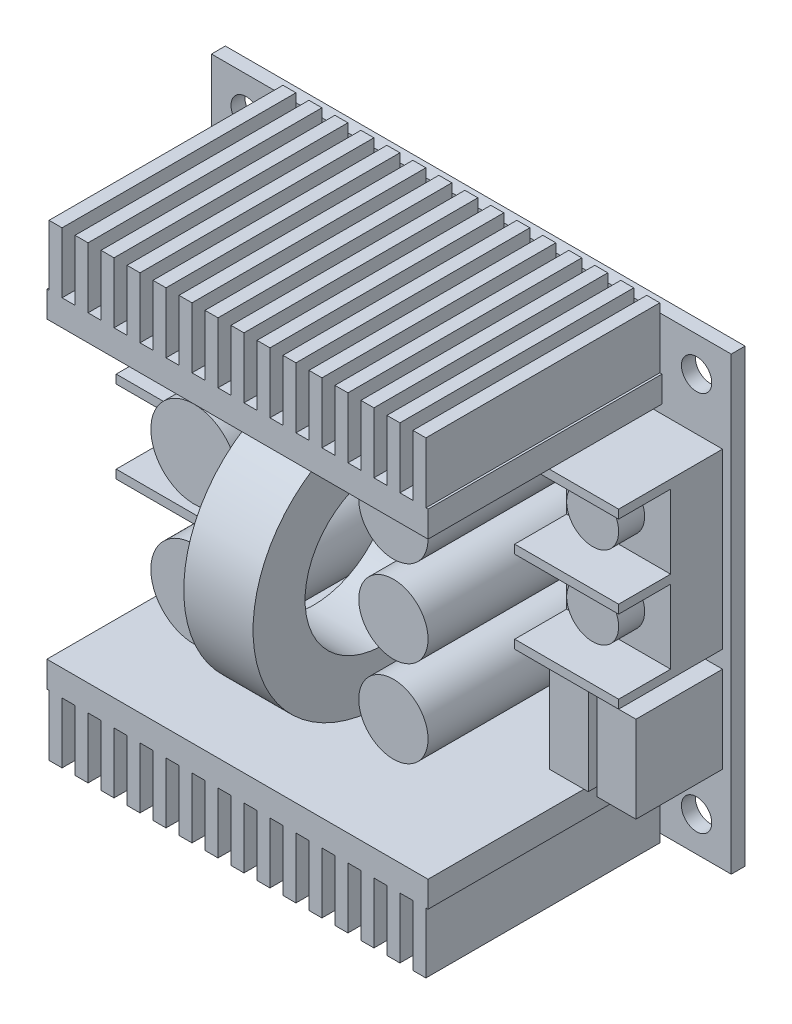
from build123d import *

# Parameters (mm, degrees)
SKETCH1_W           = 60
SKETCH1_H           = 52
BOSS_EXTRUDE1_DEPTH = 0.8
SKETCH2_W           = 44
SKETCH2_H           = 10
BOSS_EXTRUDE2_DEPTH = 27
SKETCH3_W           = 1.5
SKETCH3_H           = 7
CUT_EXTRUDE1_DEPTH  = 27
SKETCH4_R           = 1.75
CUT_EXTRUDE2_DEPTH  = 49.559242169
SKETCH5_W           = 4.5
SKETCH5_H           = 10
BOSS_EXTRUDE3_DEPTH = 10
SKETCH6_W           = 12
SKETCH6_H           = 20
BOSS_EXTRUDE4_DEPTH = 12
SKETCH7_W           = 12
SKETCH7_H           = 8.5
CUT_EXTRUDE3_DEPTH  = 6
SKETCH8_R           = 3
BOSS_EXTRUDE5_DEPTH = 3
SKETCH9_R           = 4
BOSS_EXTRUDE6_DEPTH = 20
SKETCH10_R          = 5
BOSS_EXTRUDE7_DEPTH = 22
SKETCH11_R          = 15
SKETCH11_R_2        = 9
BOSS_EXTRUDE8_DEPTH = 4


with BuildPart() as part:
    # Sketch1 → Boss-Extrude1 (new, symmetric)
    with BuildSketch(Plane.XY):
        Rectangle(SKETCH1_W, SKETCH1_H)
    extrude(amount=BOSS_EXTRUDE1_DEPTH, both=True)

    # Sketch2 → Boss-Extrude2 (add)
    with BuildSketch(Plane.XY.offset(0.8)):
        with Locations((0, -22)):
            Rectangle(SKETCH2_W, SKETCH2_H)
        with Locations((0, 22)):
            Rectangle(SKETCH2_W, SKETCH2_H)
    extrude(amount=BOSS_EXTRUDE2_DEPTH)

    # Sketch3 → Cut-Extrude1 (cut)
    with BuildSketch(Plane.XY.offset(27.8)):
        with Locations((-22.5, -23.5)):
            Rectangle(SKETCH3_W, SKETCH3_H)
        with Locations((-19.5, -23.5)):
            Rectangle(SKETCH3_W, SKETCH3_H)
        with Locations((-16.5, -23.5)):
            Rectangle(SKETCH3_W, SKETCH3_H)
        with Locations((-13.5, -23.5)):
            Rectangle(SKETCH3_W, SKETCH3_H)
        with Locations((-10.5, -23.5)):
            Rectangle(SKETCH3_W, SKETCH3_H)
        with Locations((-7.5, -23.5)):
            Rectangle(SKETCH3_W, SKETCH3_H)
        with Locations((-4.5, -23.5)):
            Rectangle(SKETCH3_W, SKETCH3_H)
        with Locations((-1.5, -23.5)):
            Rectangle(SKETCH3_W, SKETCH3_H)
        with Locations((1.5, -23.5)):
            Rectangle(SKETCH3_W, SKETCH3_H)
        with Locations((4.5, -23.5)):
            Rectangle(SKETCH3_W, SKETCH3_H)
        with Locations((7.5, -23.5)):
            Rectangle(SKETCH3_W, SKETCH3_H)
        with Locations((10.5, -23.5)):
            Rectangle(SKETCH3_W, SKETCH3_H)
        with Locations((13.5, -23.5)):
            Rectangle(SKETCH3_W, SKETCH3_H)
        with Locations((16.5, -23.5)):
            Rectangle(SKETCH3_W, SKETCH3_H)
        with Locations((19.5, -23.5)):
            Rectangle(SKETCH3_W, SKETCH3_H)
        with Locations((22.5, -23.5)):
            Rectangle(SKETCH3_W, SKETCH3_H)
        with Locations((22.5, 23.5)):
            Rectangle(SKETCH3_W, SKETCH3_H)
        with Locations((19.5, 23.5)):
            Rectangle(SKETCH3_W, SKETCH3_H)
        with Locations((16.5, 23.5)):
            Rectangle(SKETCH3_W, SKETCH3_H)
        with Locations((13.5, 23.5)):
            Rectangle(SKETCH3_W, SKETCH3_H)
        with Locations((10.5, 23.5)):
            Rectangle(SKETCH3_W, SKETCH3_H)
        with Locations((7.5, 23.5)):
            Rectangle(SKETCH3_W, SKETCH3_H)
        with Locations((4.5, 23.5)):
            Rectangle(SKETCH3_W, SKETCH3_H)
        with Locations((1.5, 23.5)):
            Rectangle(SKETCH3_W, SKETCH3_H)
        with Locations((-1.5, 23.5)):
            Rectangle(SKETCH3_W, SKETCH3_H)
        with Locations((-4.5, 23.5)):
            Rectangle(SKETCH3_W, SKETCH3_H)
        with Locations((-7.5, 23.5)):
            Rectangle(SKETCH3_W, SKETCH3_H)
        with Locations((-10.5, 23.5)):
            Rectangle(SKETCH3_W, SKETCH3_H)
        with Locations((-13.5, 23.5)):
            Rectangle(SKETCH3_W, SKETCH3_H)
        with Locations((-16.5, 23.5)):
            Rectangle(SKETCH3_W, SKETCH3_H)
        with Locations((-19.5, 23.5)):
            Rectangle(SKETCH3_W, SKETCH3_H)
        with Locations((-22.5, 23.5)):
            Rectangle(SKETCH3_W, SKETCH3_H)
    extrude(amount=-CUT_EXTRUDE1_DEPTH, mode=Mode.SUBTRACT)

    # Sketch4 → Cut-Extrude2 (cut, through all)
    with BuildSketch(Plane.XY.offset(0.8)):
        with Locations((-26, -22)):
            Circle(SKETCH4_R)
        with Locations(Location((-26, 22, 0), (0, 0, 180))):
            Circle(SKETCH4_R)
        with Locations((26, 22)):
            Circle(SKETCH4_R)
        with Locations(Location((26, -22, 0), (0, 0, 180))):
            Circle(SKETCH4_R)
    extrude(amount=-CUT_EXTRUDE2_DEPTH, mode=Mode.SUBTRACT)

    # Sketch5 → Boss-Extrude3 (add)
    with BuildSketch(Plane.XY.offset(0.8)):
        with Locations((21.25, -11)):
            Rectangle(SKETCH5_W, SKETCH5_H)
        with Locations((26.75, -11)):
            Rectangle(SKETCH5_W, SKETCH5_H)
    extrude(amount=BOSS_EXTRUDE3_DEPTH)

    # Sketch6 → Boss-Extrude4 (add)
    with BuildSketch(Plane.XY.offset(0.8)):
        with Locations((23, 6)):
            Rectangle(SKETCH6_W, SKETCH6_H)
        with Locations((-23, 0)):
            Rectangle(SKETCH6_W, SKETCH6_H)
    extrude(amount=BOSS_EXTRUDE4_DEPTH)

    # Sketch7 → Cut-Extrude3 (cut)
    with BuildSketch(Plane.XY.offset(12.8)):
        with Locations((23, 10.75)):
            Rectangle(SKETCH7_W, SKETCH7_H)
        with Locations((23, 1.25)):
            Rectangle(SKETCH7_W, SKETCH7_H)
        with Locations((-23, 4.75)):
            Rectangle(SKETCH7_W, SKETCH7_H)
        with Locations((-23, -4.75)):
            Rectangle(SKETCH7_W, SKETCH7_H)
    extrude(amount=-CUT_EXTRUDE3_DEPTH, mode=Mode.SUBTRACT)

    # Sketch8 → Boss-Extrude5 (add)
    with BuildSketch(Plane.XY.offset(6.8)):
        with Locations((23, 10.75)):
            Circle(SKETCH8_R)
        with Locations((23, 1.25)):
            Circle(SKETCH8_R)
        with Locations((-23, 4.75)):
            Circle(SKETCH8_R)
        with Locations((-23, -4.75)):
            Circle(SKETCH8_R)
    extrude(amount=BOSS_EXTRUDE5_DEPTH)

    # Sketch9 → Boss-Extrude6 (add)
    with BuildSketch(Plane.XY.offset(0.8)):
        with Locations((11, 0)):
            Circle(SKETCH9_R)
        with Locations((11, -10)):
            Circle(SKETCH9_R)
        with Locations(Location((11, 10, 0), (0, 0, 180))):
            Circle(SKETCH9_R)
    extrude(amount=BOSS_EXTRUDE6_DEPTH)

    # Sketch10 → Boss-Extrude7 (add)
    with BuildSketch(Plane.XY.offset(0.8)):
        with Locations((-10, 7)):
            Circle(SKETCH10_R)
        with Locations(Location((-10, -7, 0), (0, 0, 180))):
            Circle(SKETCH10_R)
    extrude(amount=BOSS_EXTRUDE7_DEPTH)

    # Sketch11 → Boss-Extrude8 (add, symmetric)
    with BuildSketch(Plane(origin=(0, 0, 0), x_dir=(0, 0, -1), z_dir=(1, 0, 0))):
        with Locations((-15, 0)):
            Circle(SKETCH11_R)
        with Locations((-15, 0)):
            Circle(SKETCH11_R_2, mode=Mode.SUBTRACT)
    extrude(amount=BOSS_EXTRUDE8_DEPTH, both=True)


solid = part.part
